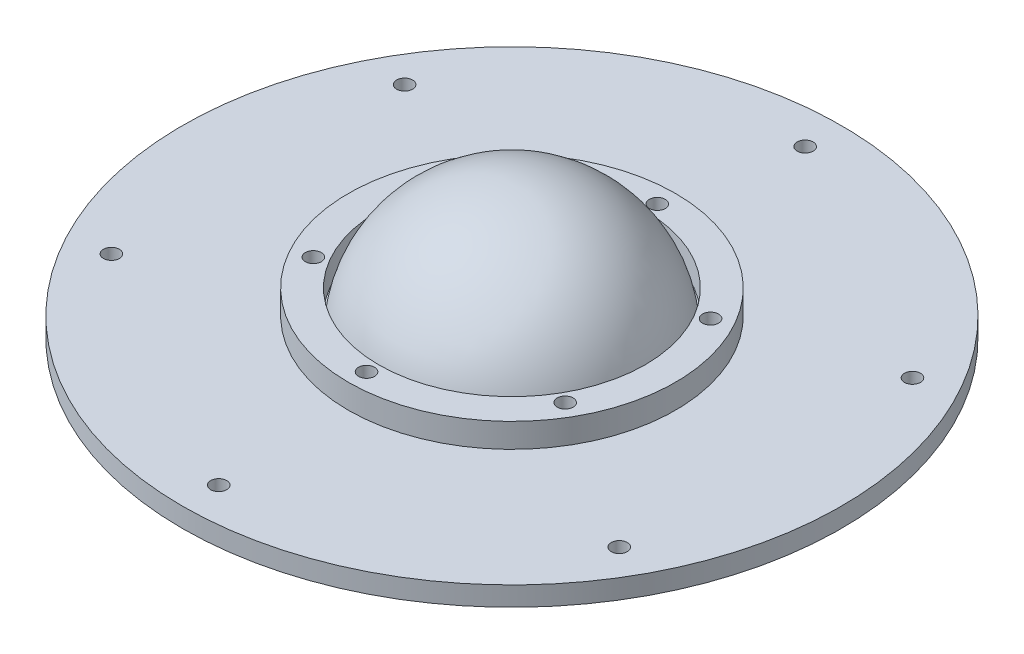
from build123d import *

# Parameters (mm, degrees)
SKETCH2_R           = 136
BOSS_EXTRUDE1_DEPTH = 8
SKETCH3_R           = 111.5
SKETCH3_R_2         = 108.5
CUT_EXTRUDE1_DEPTH  = 2
SKETCH4_R           = 3.3
CUT_EXTRUDE2_DEPTH  = 22
CIRPATTERN1_COUNT   = 6
SKETCH6_R           = 67.5
SKETCH6_R_2         = 55
BOSS_EXTRUDE2_DEPTH = 10
SKETCH7_R           = 3.3
CUT_EXTRUDE3_DEPTH  = 15
CIRPATTERN2_COUNT   = 6


with BuildPart() as part:
    # Sketch1 → Revolve1 (revolve)
    with BuildSketch(Plane.XY, mode=Mode.PRIVATE) as revolve1_sk:
        with BuildLine():
            Line((-65, 0), (-65, 5))
            Line((-65, 5), (-54.772255751, 5))
            ThreePointArc((-54.772255751, 5), (-37.080992435, 40.620192023), (0, 55))
            Line((0, 55), (0, 50))
            ThreePointArc((0, 50), (-35.355339059, 35.355339059), (-50, 0))
            Line((-50, 0), (-65, 0))
        make_face()
    revolve(revolve1_sk.sketch.rotate(Axis((0, 0, 0), (0, 1, 0)), 180), axis=Axis((0, 0, 0), (0, 1, 0)))

    # Sketch2 → Boss-Extrude1 (add)
    with BuildSketch(Plane(origin=(0, 0, 0), x_dir=(1, 0, 0), z_dir=(0, 1, 0))):
        with Locations(Location((0, 0, 0), (0, 0, 270))):
            Circle(SKETCH2_R)
    extrude(amount=BOSS_EXTRUDE1_DEPTH)

    # Sketch3 → Cut-Extrude1 (cut)
    with BuildSketch(Plane(origin=(0, 0, 0), x_dir=(1, 0, 0), z_dir=(0, 1, 0))):
        with Locations(Location((0, 0, 0), (0, 0, 180))):
            Circle(SKETCH3_R)
        with Locations(Location((0, 0, 0), (0, 0, 180))):
            Circle(SKETCH3_R_2, mode=Mode.SUBTRACT)
    extrude(amount=CUT_EXTRUDE1_DEPTH, mode=Mode.SUBTRACT)

    # Sketch4 → Cut-Extrude2 (cut)
    with BuildSketch(Plane(origin=(0, 0, 0), x_dir=(-1, 0, 0), z_dir=(0, -1, 0))):
        with Locations(Location((0, 121, 0), (0, 0, 180))):
            Circle(SKETCH4_R)
    cut_extrude2 = extrude(amount=-CUT_EXTRUDE2_DEPTH, mode=Mode.SUBTRACT)

    # CirPattern1: Cut-Extrude2 ×6 about axis
    cirpattern1_axis = Axis((0, 0, 0), (0, 1, 0))
    for i in range(1, CIRPATTERN1_COUNT):
        add(cut_extrude2.rotate(cirpattern1_axis, i * 360 / CIRPATTERN1_COUNT), mode=Mode.SUBTRACT)

    # Sketch6 → Boss-Extrude2 (add)
    with BuildSketch(Plane(origin=(0, 8, 0), x_dir=(1, 0, 0), z_dir=(0, 1, 0))):
        with Locations(Location((0, 0, 0), (0, 0, 270))):
            Circle(SKETCH6_R)
        with Locations(Location((0, 0, 0), (0, 0, 270))):
            Circle(SKETCH6_R_2, mode=Mode.SUBTRACT)
    extrude(amount=BOSS_EXTRUDE2_DEPTH)

    # Sketch7 → Cut-Extrude3 (cut)
    with BuildSketch(Plane(origin=(0, 18, 0), x_dir=(1, 0, 0), z_dir=(0, 1, 0))):
        with Locations(Location((0, -60, 0), (0, 0, 270))):
            Circle(SKETCH7_R)
    cut_extrude3 = extrude(amount=-CUT_EXTRUDE3_DEPTH, mode=Mode.SUBTRACT)

    # CirPattern2: Cut-Extrude3 ×6 about axis
    cirpattern2_axis = Axis((0, 0, 0), (0, 1, 0))
    for i in range(1, CIRPATTERN2_COUNT):
        add(cut_extrude3.rotate(cirpattern2_axis, i * 360 / CIRPATTERN2_COUNT), mode=Mode.SUBTRACT)


solid = part.part
